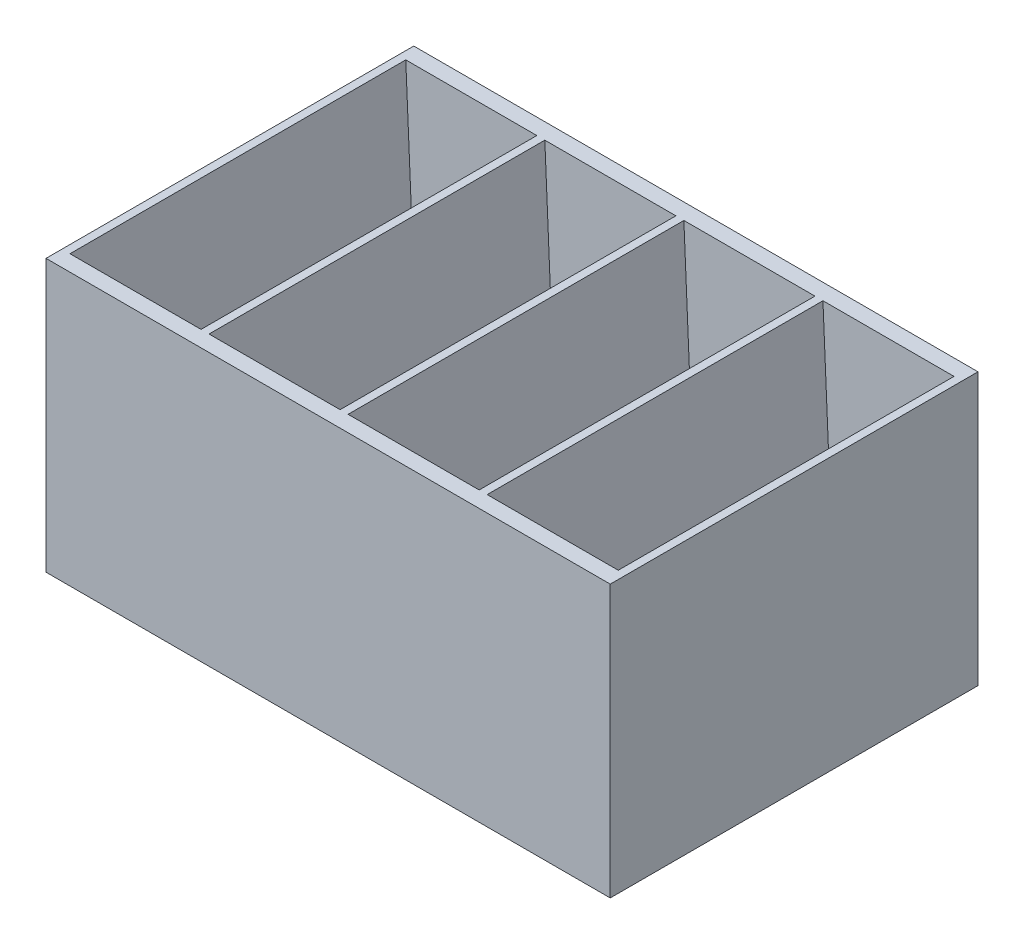
from build123d import *

# Parameters (mm, degrees)
BOSS_EXTRUDE1_DEPTH = 146.05
BOSS_EXTRUDE2_DEPTH = 6.35


with BuildPart() as part:
    # Sketch1 → Boss-Extrude1 (new body)
    with BuildSketch(Plane.XY):
        Polygon((0, 0), (0, 107.95), (3.175, 107.95), (7.6109518, 6.35), (50.7909518, 6.35), (55.226903599, 107.95), (58.401903599, 107.95), (62.837855399, 6.35), (106.017855399, 6.35), (110.453807198, 107.95), (113.628807198, 107.95), (118.064758998, 6.35), (161.244758998, 6.35), (165.680710797, 107.95), (168.855710797, 107.95), (173.291662597, 6.35), (216.471662597, 6.35), (220.907614396, 107.95), (224.082614396, 107.95), (224.082614396, 0), align=None)
    extrude(amount=BOSS_EXTRUDE1_DEPTH)

    # Sketch2 → Boss-Extrude2 (add)
    with BuildSketch(Plane.XY.offset(146.05)):
        Polygon((3.175, 107.95), (55.226903599, 107.95), (50.7909518, 6.35), (7.6109518, 6.35), align=None)
        Polygon((58.401903599, 107.95), (62.837855399, 6.35), (106.017855399, 6.35), (110.453807198, 107.95), align=None)
        Polygon((113.628807198, 107.95), (118.064758998, 6.35), (161.244758998, 6.35), (165.680710797, 107.95), align=None)
        Polygon((168.855710797, 107.95), (173.291662597, 6.35), (216.471662597, 6.35), (220.907614396, 107.95), align=None)
    boss_extrude2 = extrude(amount=-BOSS_EXTRUDE2_DEPTH)

    # Mirror1: Boss-Extrude2 across plane
    add(boss_extrude2.mirror(Plane(origin=(0, 0, 73.025), x_dir=(1, 0, 0), z_dir=(0, 0, -1))))


solid = part.part
